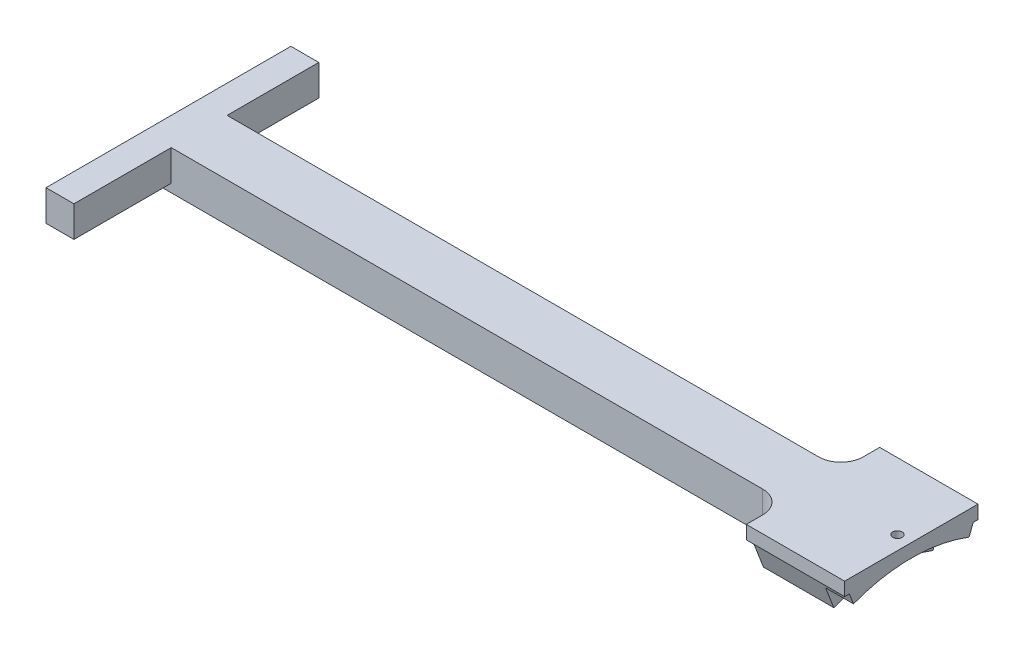
from build123d import *

# Parameters (mm, degrees)
EXTRUDE_1_DEPTH     = 10
EXTRUDE_START       = 10
EXTRUDE_2_DEPTH     = 10
EXTRUDE_START_2     = -20
SKETCH_5_W          = 47.76055714
SKETCH_5_H          = 4.8
EXTRUDE_3_DEPTH     = 20
SKETCH_4_R          = 1.7
CUT_EXTRUDE_1_DEPTH = 70.746966001
EXTRUDE_1_2_DEPTH   = 245
CUT_EXTRUDE_2_DEPTH = 267.572630949
SKETCH_8_W          = 87.68405268
SKETCH_8_H          = 11.060470773
EXTRUDE_2_2_DEPTH   = 10


with BuildPart() as part:
    # 草图2 → Extrude 1 (new body)
    with BuildSketch(Plane.ZY.offset(10)):
        with BuildLine():
            ThreePointArc((17.754161429, 46.104597493), (0, 49.404900142), (-17.754161429, 46.104597493))
            Line((-17.754161429, 46.104597493), (-22.425845774, 58.236182937))
            ThreePointArc((-22.425845774, 58.236182937), (0, 62.404900142), (22.425845774, 58.236182937))
            Line((22.425845774, 58.236182937), (17.754161429, 46.104597493))
        make_face()
    extrude(amount=EXTRUDE_1_DEPTH)

    # 草图3 → Extrude 2 (add)
    with BuildSketch(Plane(origin=(-10, 0, 0), x_dir=(0, 0, -1), z_dir=(1, 0, 0)).offset(EXTRUDE_START)):
        with BuildLine():
            ThreePointArc((22.425845774, 58.236182937), (0, 62.404900142), (-22.425845774, 58.236182937))
            Line((-22.425845774, 58.236182937), (-20.700916169, 53.756828311))
            ThreePointArc((-20.700916169, 53.756828311), (0, 57.604900142), (20.700916169, 53.756828311))
            Line((20.700916169, 53.756828311), (22.425845774, 58.236182937))
        make_face()
    extrude(amount=-EXTRUDE_2_DEPTH)

    # 草图5 → 拉伸-薄壁3 (add)
    with BuildSketch(Plane(origin=(0, 0, 0), x_dir=(0, 0, -1), z_dir=(1, 0, 0)).offset(EXTRUDE_START_2)):
        with Locations((0, 60.004900142)):
            Rectangle(SKETCH_5_W, SKETCH_5_H)
    extrude(amount=EXTRUDE_3_DEPTH)

    # 草图4 → 切除-拉伸1 (cut, through all)
    with BuildSketch(Plane(origin=(0, 0, 0), x_dir=(1, 0, 0), z_dir=(0, 1, 0))):
        with Locations(Location((-4.960065679, 0, 0), (0, 0, 90))):
            Circle(SKETCH_4_R)
    extrude(amount=CUT_EXTRUDE_1_DEPTH, mode=Mode.SUBTRACT)

    # 草图6 → Extrude 1 2 (add)
    with BuildSketch(Plane.ZY.offset(20)):
        with BuildLine():
            Line((23.88027857, 62.404900142), (-23.88027857, 62.404900142))
            Line((-23.88027857, 62.404900142), (-23.88027857, 57.604900142))
            Line((-23.88027857, 57.604900142), (-22.182748615, 57.604900142))
            Line((-22.182748615, 57.604900142), (-17.754161429, 46.104597493))
            ThreePointArc((-17.754161429, 46.104597493), (0, 49.404900142), (17.754161429, 46.104597493))
            Line((17.754161429, 46.104597493), (22.182748615, 57.604900142))
            Line((22.182748615, 57.604900142), (23.88027857, 57.604900142))
            Line((23.88027857, 57.604900142), (23.88027857, 62.404900142))
        make_face()
    extrude(amount=EXTRUDE_1_2_DEPTH)

    # 草图7 → 切除-拉伸2 (cut, through all)
    with BuildSketch(Plane(origin=(0, 62.404900142, 0), x_dir=(1, 0, 0), z_dir=(0, 1, 0))):
        with BuildLine():
            Line((-35.208375229, 23.88027857), (-35.208375229, 18))
            ThreePointArc((-35.208375229, 18), (-37.55152098, 12.343145751), (-43.208375229, 10))
            Line((-43.208375229, 10), (-265, 10))
            Line((-265, 10), (-265, 23.88027857))
            Line((-265, 23.88027857), (-35.208375229, 23.88027857))
        make_face()
        with BuildLine():
            Line((-43.208375229, -10), (-265, -10))
            Line((-265, -10), (-265, -23.88027857))
            Line((-265, -23.88027857), (-35.208375229, -23.88027857))
            Line((-35.208375229, -23.88027857), (-35.208375229, -18))
            ThreePointArc((-35.208375229, -18), (-37.55152098, -12.343145751), (-43.208375229, -10))
        make_face()
    extrude(amount=-CUT_EXTRUDE_2_DEPTH, mode=Mode.SUBTRACT)

    # 草图8 → Extrude 2 2 (add)
    with BuildSketch(Plane.ZY.offset(265)):
        with Locations((1.006520642, 56.874664756)):
            Rectangle(SKETCH_8_W, SKETCH_8_H)
    extrude(amount=-EXTRUDE_2_2_DEPTH)


solid = part.part
